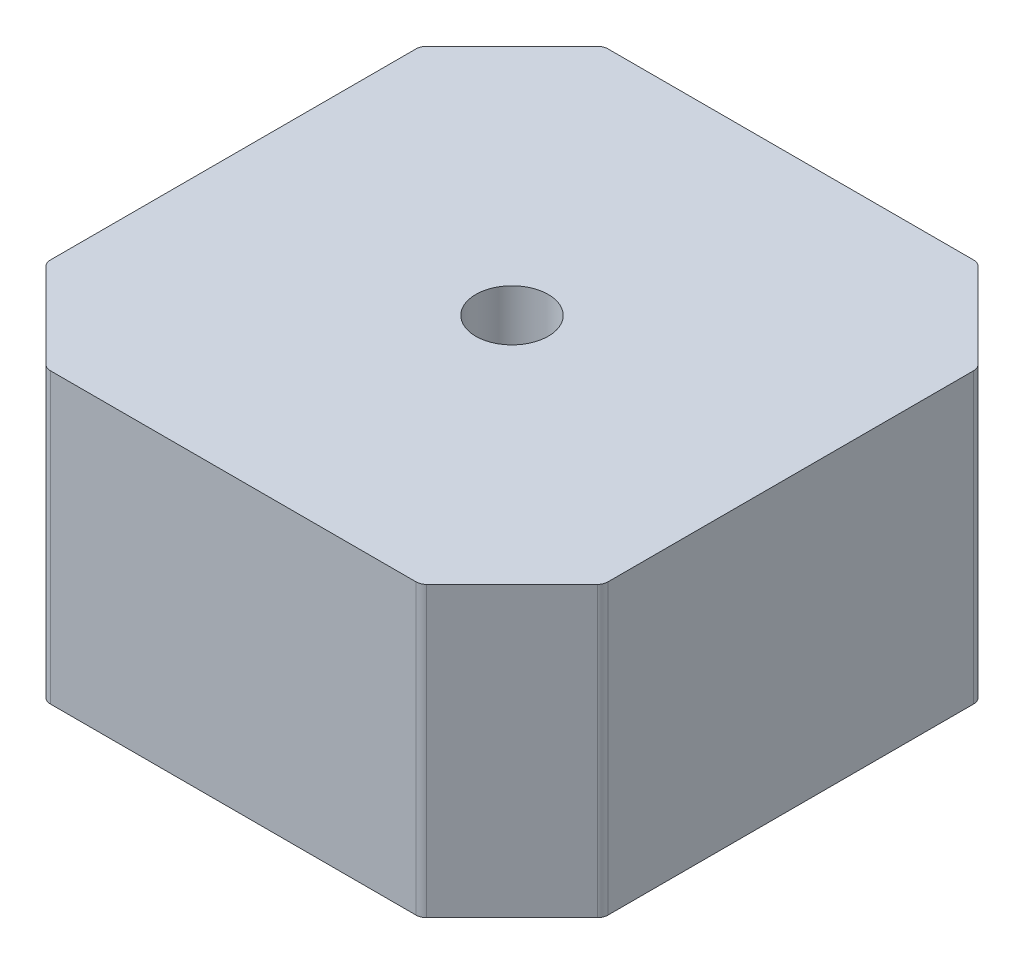
from build123d import *

# Parameters (mm, degrees)
BOSS_EXTRUDE1_DEPTH     = 21.9
CUT_EXTRUDE1_DEPTH      = 38.070945496
CUT_EXTRUDE1_DEPTH_BACK = 38.070945496
SKETCH2_R               = 2.75


with BuildPart() as part:
    # Sketch1 → Boss-Extrude1 (new body)
    with BuildSketch(Plane(origin=(0, 0, 0), x_dir=(1, 0, 0), z_dir=(0, 1, 0))):
        with BuildLine():
            Line((-14.442201826, 20.913137233), (-20.913137233, 14.442201826))
            ThreePointArc((-20.913137233, 14.442201826), (-21.088441372, 14.179840641), (-21.15, 13.870364522))
            Line((-21.15, 13.870364522), (-21.15, -13.870364522))
            ThreePointArc((-21.15, -13.870364522), (-21.088441372, -14.179840641), (-20.913137233, -14.442201826))
            Line((-20.913137233, -14.442201826), (-14.442201826, -20.913137233))
            ThreePointArc((-14.442201826, -20.913137233), (-14.179840641, -21.088441372), (-13.870364522, -21.15))
            Line((-13.870364522, -21.15), (13.870364522, -21.15))
            ThreePointArc((13.870364522, -21.15), (14.179840641, -21.088441372), (14.442201826, -20.913137233))
            Line((14.442201826, -20.913137233), (20.913137233, -14.442201826))
            ThreePointArc((20.913137233, -14.442201826), (21.088441372, -14.179840641), (21.15, -13.870364522))
            Line((21.15, -13.870364522), (21.15, 13.870364522))
            ThreePointArc((21.15, 13.870364522), (21.088441372, 14.179840641), (20.913137233, 14.442201826))
            Line((20.913137233, 14.442201826), (14.442201826, 20.913137233))
            ThreePointArc((14.442201826, 20.913137233), (14.179840641, 21.088441372), (13.870364522, 21.15))
            Line((13.870364522, 21.15), (-13.870364522, 21.15))
            ThreePointArc((-13.870364522, 21.15), (-14.179840641, 21.088441372), (-14.442201826, 20.913137233))
        make_face()
    extrude(amount=BOSS_EXTRUDE1_DEPTH)

    # Sketch2 → Cut-Extrude1 (cut, two sides: drawn at the far end of the back side and taken through both)
    with BuildSketch(Plane(origin=(0, 21.9, 0), x_dir=(1, 0, 0), z_dir=(0, 1, 0)).offset(-CUT_EXTRUDE1_DEPTH_BACK)):
        with Locations(Location((0, 0, 0), (0, 0, 270))):
            Circle(SKETCH2_R)
    extrude(amount=CUT_EXTRUDE1_DEPTH + CUT_EXTRUDE1_DEPTH_BACK, mode=Mode.SUBTRACT)


solid = part.part
